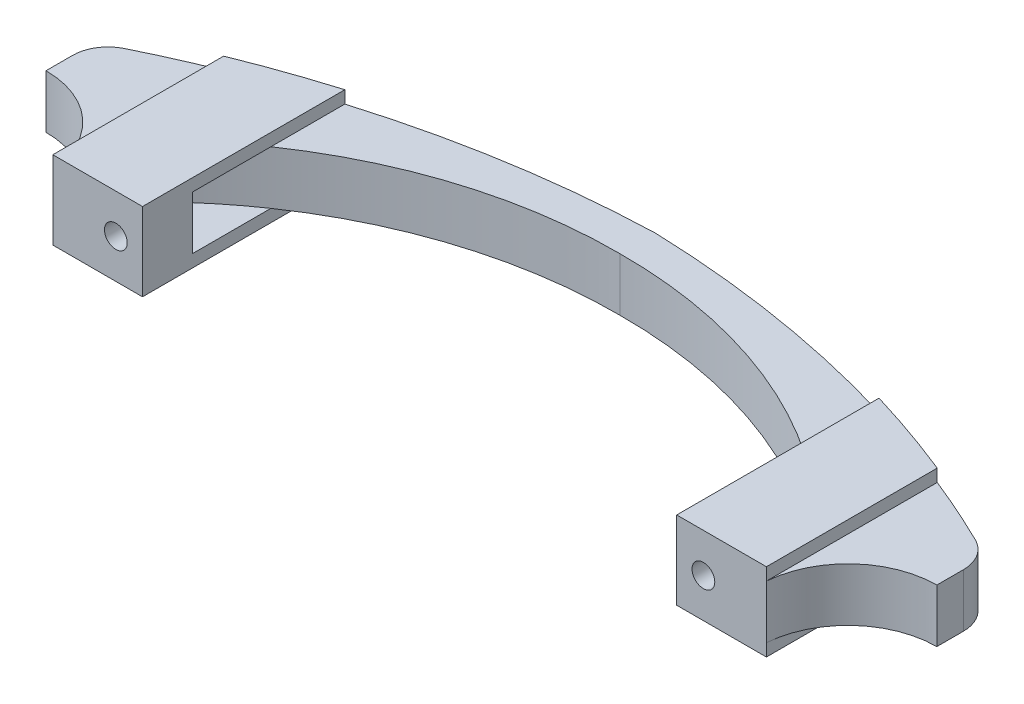
from build123d import *

# Parameters (mm, degrees)
BOSS_EXTRUDE1_DEPTH  = 7.5
SKETCH2_R            = 1.6
CUT_EXTRUDE1_DEPTH   = 65.077737633
BOSS_EXTRUDE4_START  = -7.5
BOSS_EXTRUDE4_DEPTH  = 7.5
SKETCH4_R            = 1.6
CUT_EXTRUDE2_DEPTH   = 2.6
SKETCH6_R            = 156.176390482
CUT_EXTRUDE3_DEPTH   = 1
FILLET1_R            = 5
FILLET2_R            = 5
FILLET3_R            = 5
FILLET4_R            = 5
BOSS_EXTRUDE5_DEPTH  = 1.75
MIRROR9_COPY_1_DEPTH = 1.75


with BuildPart() as part:
    # Sketch1 → Boss-Extrude1 (new body)
    with BuildSketch(Plane(origin=(0, 0, 0), x_dir=(1, 0, 0), z_dir=(0, 1, 0))):
        with BuildLine():
            ThreePointArc((-53.020313644, 8), (-50.871094703, 4.253905297), (-50.125, 0))
            ThreePointArc((-50.125, 0), (-49.964111284, 4.012880342), (-49.482477959, 8))
            Line((-49.482477959, 8), (-53.020313644, 8))
        make_face()
        with BuildLine():
            ThreePointArc((-49.482477959, 8), (-49.964111284, 4.012880342), (-50.125, 0))
            Line((-50.125, 0), (-43.319433445, 0))
            ThreePointArc((-43.319433445, 0), (-43.758313694, 4.093048719), (-45.055, 8))
            Line((-45.055, 8), (-49.482477959, 8))
        make_face()
        with BuildLine():
            ThreePointArc((-45.055, 8), (-43.758313694, 4.093048719), (-43.319433445, 0))
            Line((-43.319433445, 0), (-37.555, 0))
            Line((-37.555, 0), (-37.555, 8))
            Line((-37.555, 8), (-45.055, 8))
        make_face()
        with BuildLine():
            ThreePointArc((-48.396817166, 13.048513832), (-49.004703616, 10.538246936), (-49.482477959, 8))
            Line((-49.482477959, 8), (-45.055, 8))
            ThreePointArc((-45.055, 8), (-46.526770878, 10.656074283), (-48.396817166, 13.048513832))
        make_face()
        with BuildLine():
            ThreePointArc((-62.625, 12.5), (-57.321699141, 11.319231423), (-53.020313644, 8))
            Line((-53.020313644, 8), (-49.482477959, 8))
            ThreePointArc((-49.482477959, 8), (-49.004703616, 10.538246936), (-48.396817166, 13.048513832))
            ThreePointArc((-48.396817166, 13.048513832), (-54.853386661, 17.672207732), (-62.625, 19.305566555))
            Line((-62.625, 19.305566555), (-62.625, 12.5))
        make_face()
    boss_extrude1 = extrude(amount=BOSS_EXTRUDE1_DEPTH)

    # Sketch2 → Cut-Extrude1 (cut, through all)
    with BuildSketch(Plane(origin=(0, 0, -8), x_dir=(-1, 0, 0), z_dir=(0, 0, -1))):
        with Locations((41.305, 3.75)):
            Circle(SKETCH2_R)
    cut_extrude1 = extrude(amount=-CUT_EXTRUDE1_DEPTH, mode=Mode.SUBTRACT)

    # Sketch3 → Boss-Extrude4 (add)
    with BuildSketch(Plane(origin=(0, 7.5, 0), x_dir=(1, 0, 0), z_dir=(0, 1, 0)).offset(BOSS_EXTRUDE4_START)):
        with BuildLine():
            ThreePointArc((-62.625, 19.305566555), (-53.806914146, 17.173999589), (-46.936073969, 11.25))
            ThreePointArc((-46.936073969, 11.25), (-25.405775196, 25.617547828), (0, 30.57))
            Line((0, 30.57), (0, 35.57))
            ThreePointArc((0, 35.57), (-32.221430215, 30.937551956), (-62.625, 19.305566555))
        make_face()
    boss_extrude4 = extrude(amount=BOSS_EXTRUDE4_DEPTH)

    # Sketch4 → Cut-Extrude2 (cut)
    with BuildSketch(Plane(origin=(0, 0, -8), x_dir=(-1, 0, 0), z_dir=(0, 0, -1))):
        Polygon((39.735, 1.030680232), (42.875, 1.030680232), (44.445, 3.75), (42.875, 6.469319768), (39.735, 6.469319768), (38.165, 3.75), align=None)
        with Locations((41.305, 3.75)):
            Circle(SKETCH4_R, mode=Mode.SUBTRACT)
    cut_extrude2 = extrude(amount=-CUT_EXTRUDE2_DEPTH, mode=Mode.SUBTRACT)

    # Mirror5: Boss-Extrude4 across plane
    add(boss_extrude4.mirror(Plane(origin=(0, 0, 0), x_dir=(0, 0, 1), z_dir=(1, 0, 0))))

    # Mirror6: Boss-Extrude1 across plane
    add(boss_extrude1.mirror(Plane(origin=(0, 0, 0), x_dir=(0, 0, 1), z_dir=(1, 0, 0))))

    # Mirror7: Cut-Extrude1, Cut-Extrude2 across plane
    add(cut_extrude1.mirror(Plane(origin=(0, 0, 0), x_dir=(0, 0, 1), z_dir=(1, 0, 0))), mode=Mode.SUBTRACT)
    add(cut_extrude2.mirror(Plane(origin=(0, 0, 0), x_dir=(0, 0, 1), z_dir=(1, 0, 0))), mode=Mode.SUBTRACT)

    # Sketch6 → Cut-Extrude3 (cut)
    with BuildSketch(Plane.XY):
        Circle(SKETCH6_R)
    extrude(amount=-CUT_EXTRUDE3_DEPTH, mode=Mode.SUBTRACT)

    # Fillet1
    fillet1_edges = [part.edges().sort_by_distance(p)[0] for p in [
        (-62.625, 3.75, -19.305566555),
    ]]
    fillet(fillet1_edges, radius=FILLET1_R)

    # Fillet2
    fillet2_edges = [part.edges().sort_by_distance(p)[0] for p in [
        (62.625, 3.75, -19.305566555),
    ]]
    fillet(fillet2_edges, radius=FILLET2_R)

    # Fillet3
    fillet3_edges = [part.edges().sort_by_distance(p)[0] for p in [
        (-46.936073969, 3.75, -11.25),
    ]]
    fillet(fillet3_edges, radius=FILLET3_R)

    # Fillet4
    fillet4_edges = [part.edges().sort_by_distance(p)[0] for p in [
        (46.936073969, 3.75, -11.25),
    ]]
    fillet(fillet4_edges, radius=FILLET4_R)

    # Sketch7 → Boss-Extrude5 (add)
    with BuildSketch(Plane(origin=(0, 7.5, 0), x_dir=(1, 0, 0), z_dir=(0, 1, 0))):
        with BuildLine():
            Line((-50.165064206, 1), (-37.555, 1))
            Line((-37.555, 1), (-37.555, 29.44421276))
            ThreePointArc((-37.555, 29.44421276), (-43.910509627, 27.37533218), (-50.165064206, 25.0187846))
            Line((-50.165064206, 25.0187846), (-50.165064206, 1))
        make_face()
    boss_extrude5 = extrude(amount=BOSS_EXTRUDE5_DEPTH)

    # Mirror8: Boss-Extrude5 across plane
    add(boss_extrude5.mirror(Plane.ZX.offset(3.75)))

    # Mirror9: Boss-Extrude5 across plane
    add(boss_extrude5.mirror(Plane(origin=(0, 0, 0), x_dir=(0, 0, 1), z_dir=(1, 0, 0))))

    # Mirror9 copy 1 sketch → Mirror9 copy 1 (add)
    with BuildSketch(Plane(origin=(0, 0, 0), x_dir=(-1, 0, 0), z_dir=(0, -1, 0))):
        with BuildLine():
            Line((-50.165064206, 1), (-37.555, 1))
            Line((-37.555, 1), (-37.555, 29.44421276))
            ThreePointArc((-37.555, 29.44421276), (-43.910509627, 27.37533218), (-50.165064206, 25.0187846))
            Line((-50.165064206, 25.0187846), (-50.165064206, 1))
        make_face()
    extrude(amount=MIRROR9_COPY_1_DEPTH)


solid = part.part
